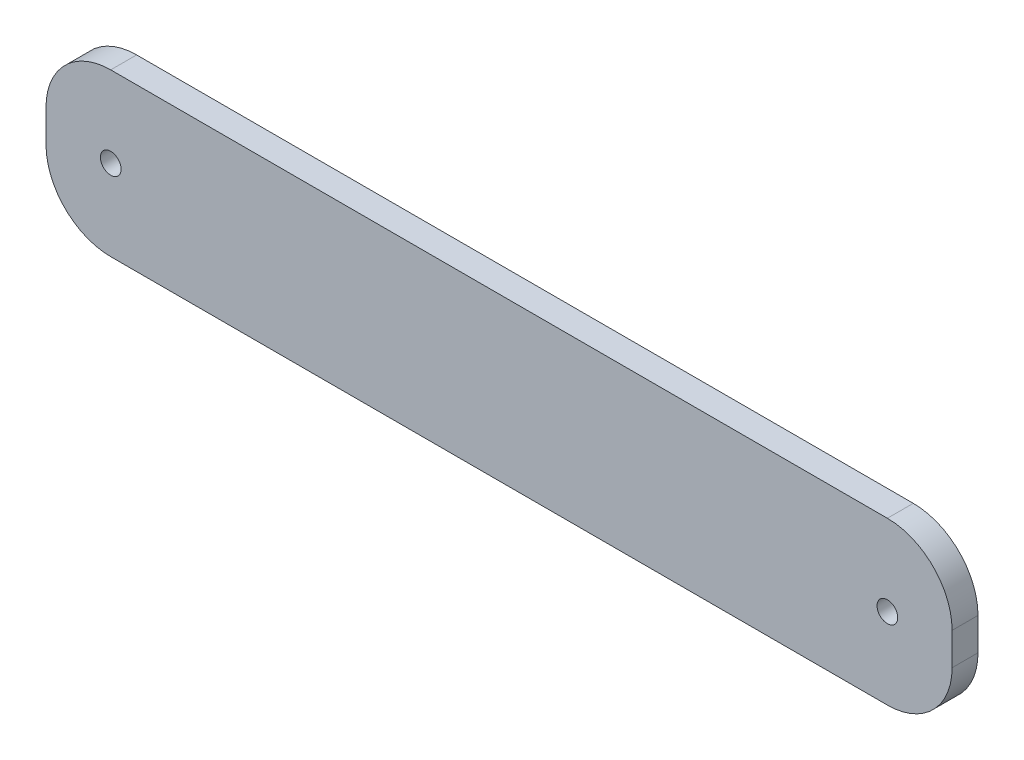
from build123d import *

# Parameters (mm, degrees)
SKETCH_1_W      = 140
SKETCH_1_H      = 25
SKETCH_1_R      = 1.6
EXTRUDE_1_DEPTH = 4
FILLET_1_R      = 10


with BuildPart() as part:
    # 草图1 → 凸台-拉伸1 (new body)
    with BuildSketch(Plane.XY):
        Rectangle(SKETCH_1_W, SKETCH_1_H)
        with Locations((-60, 0)):
            Circle(SKETCH_1_R, mode=Mode.SUBTRACT)
        with Locations((60, 0)):
            Circle(SKETCH_1_R, mode=Mode.SUBTRACT)
    extrude(amount=EXTRUDE_1_DEPTH)

    # 圆角1
    fillet_1_edges = [part.edges().sort_by_distance(p)[0] for p in [
        (70, -12.5, 2),
        (-70, -12.5, 2),
        (-70, 12.5, 2),
        (70, 12.5, 2),
    ]]
    fillet(fillet_1_edges, radius=FILLET_1_R)


solid = part.part
